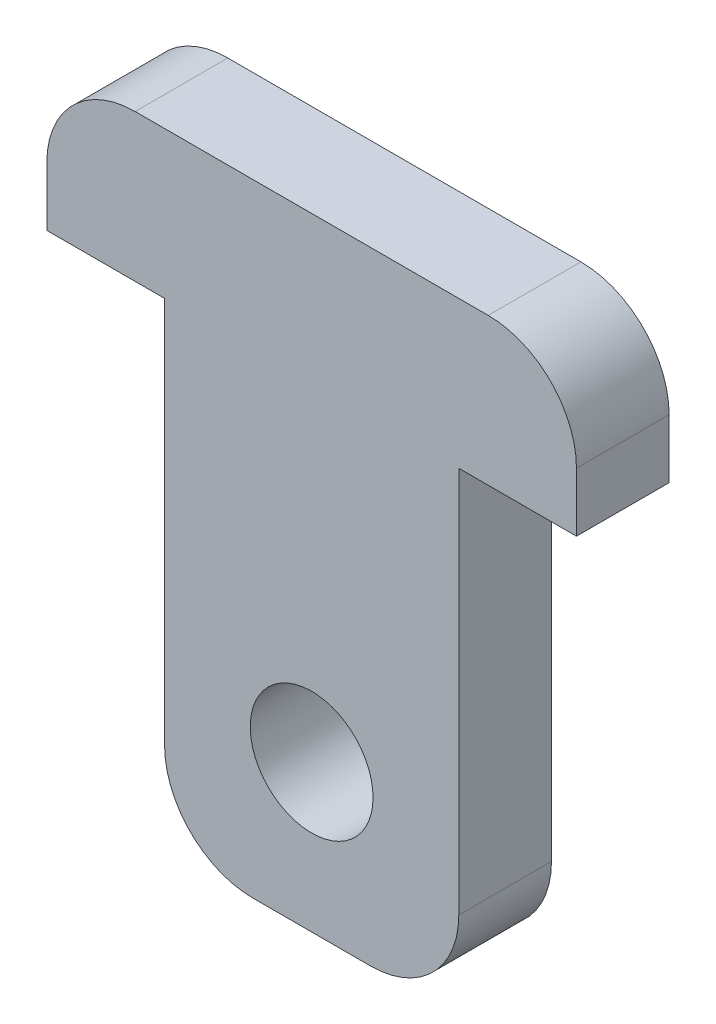
from build123d import *

# Parameters (mm, degrees)
SKETCH1_R           = 2.65
BOSS_EXTRUDE1_DEPTH = 4


with BuildPart() as part:
    # Sketch1 → Boss-Extrude1 (new body)
    with BuildSketch(Plane.XY):
        with BuildLine():
            Line((0, 0), (5.08, 0))
            Line((5.08, 0), (5.08, -16.7))
            ThreePointArc((5.08, -16.7), (6.195923164, -19.394076836), (8.89, -20.51))
            Line((8.89, -20.51), (13.97, -20.51))
            ThreePointArc((13.97, -20.51), (16.664076836, -19.394076836), (17.78, -16.7))
            Line((17.78, -16.7), (17.78, 0))
            Line((17.78, 0), (22.86, 0))
            Line((22.86, 0), (22.86, 2.54))
            ThreePointArc((22.86, 2.54), (21.744076836, 5.234076836), (19.05, 6.35))
            Line((19.05, 6.35), (3.81, 6.35))
            ThreePointArc((3.81, 6.35), (1.115923164, 5.234076836), (0, 2.54))
            Line((0, 2.54), (0, 0))
        make_face()
        with Locations((11.43, -14.16)):
            Circle(SKETCH1_R, mode=Mode.SUBTRACT)
    extrude(amount=BOSS_EXTRUDE1_DEPTH)


solid = part.part
